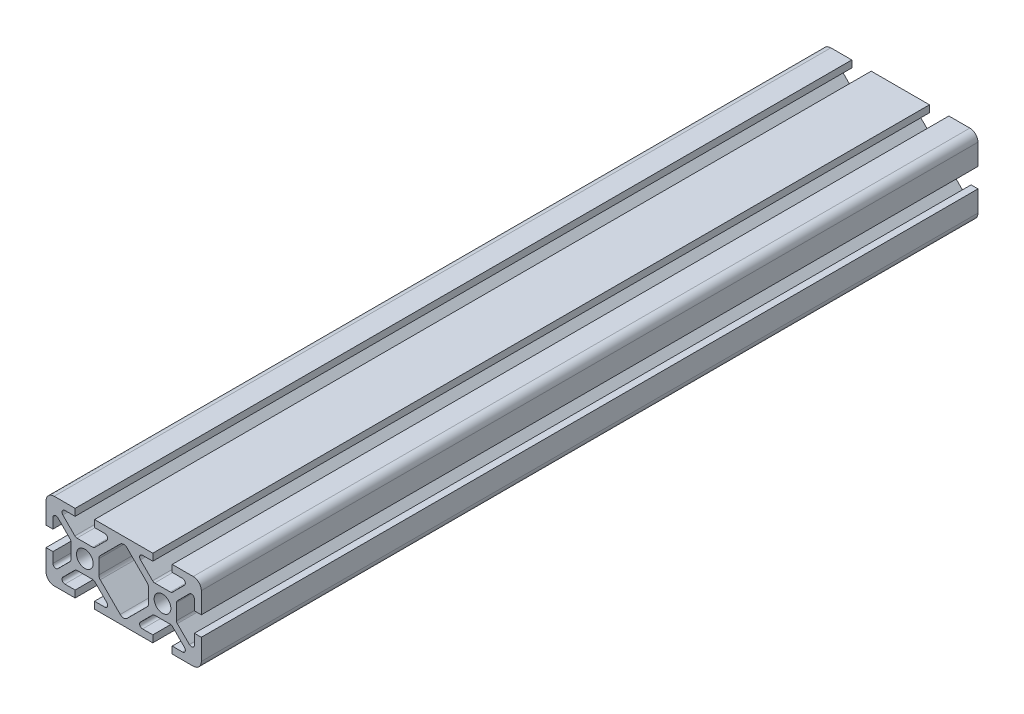
from build123d import *

# Parameters (mm, degrees)
BOSS_EXTRUDE1_DEPTH = 100.000000025
BOSS_EXTRUDE2_DEPTH = 100.000000025
FILLET1_R           = 0.75
FILLET2_R           = 1.25


with BuildPart() as part:
    # Sketch3 → Boss-Extrude1 (new, symmetric)
    with BuildSketch(Plane.XY):
        with BuildLine():
            Line((12.5, -10), (17.9, -10))
            ThreePointArc((17.9, -10), (19.38492424, -9.38492424), (20, -7.9))
            Line((20, -7.9), (20, -2.5))
            Line((20, -2.5), (18.213351365, -2.5))
            Line((18.213351365, -2.5), (18.213351365, -6.95))
            Line((18.213351365, -6.95), (13.6, -2.336648635))
            Line((13.6, -2.336648635), (13.6, 0))
            Line((13.6, 0), (12.15, 0))
            ThreePointArc((12.15, 0), (11.52027958, -1.52027958), (10, -2.15))
            Line((10, -2.15), (10, -3.6))
            Line((10, -3.6), (12.336648635, -3.6))
            Line((12.336648635, -3.6), (16.95, -8.213351365))
            Line((16.95, -8.213351365), (12.5, -8.213351365))
            Line((12.5, -8.213351365), (12.5, -10))
        make_face()
    extrude(amount=BOSS_EXTRUDE1_DEPTH, both=True)

    # Sketch4 → Boss-Extrude2 (add, symmetric)
    with BuildSketch(Plane.XY):
        with BuildLine():
            Line((10, -3.6), (7.663351365, -3.6))
            Line((7.663351365, -3.6), (3.05, -8.213351365))
            Line((3.05, -8.213351365), (7.5, -8.213351365))
            Line((7.5, -8.213351365), (7.5, -10))
            Line((7.5, -10), (0, -10))
            Line((0, -10), (0, -8.736648635))
            Line((0, -8.736648635), (6.4, -2.336648635))
            Line((6.4, -2.336648635), (6.4, 0))
            Line((6.4, 0), (7.85, 0))
            ThreePointArc((7.85, 0), (8.47972042, -1.52027958), (10, -2.15))
            Line((10, -2.15), (10, -3.6))
        make_face()
    extrude(amount=BOSS_EXTRUDE2_DEPTH, both=True)

    # Mirror1: part across plane


with BuildPart() as part_1:
    add(part.part)
    add(part.part.mirror(Plane(origin=(0, 0, 0), x_dir=(0, 0, 1), z_dir=(1, 0, 0))))

    # Mirror2: part across plane


with BuildPart() as part_2:
    add(part_1.part)
    add(part_1.part.mirror(Plane.ZX))

    # Fillet1
    fillet1_edges = [part_2.edges().sort_by_distance(p)[0] for p in [
        (18.213351365, 6.95, 0),
        (13.6, 2.336648635, 0),
        (12.336648635, 3.6, 0),
        (16.95, 8.213351365, 0),
        (3.05, 8.213351365, 0),
        (7.663351365, 3.6, 0),
        (-18.213351365, 6.95, 0),
        (-13.6, 2.336648635, 0),
        (-7.663351365, 3.6, 0),
        (-12.336648635, 3.6, 0),
        (-16.95, 8.213351365, 0),
        (-3.05, 8.213351365, 0),
        (16.95, -8.213351365, 0),
        (12.336648635, -3.6, 0),
        (13.6, -2.336648635, 0),
        (18.213351365, -6.95, 0),
        (3.05, -8.213351365, 0),
        (7.663351365, -3.6, 0),
        (-18.213351365, -6.95, 0),
        (-13.6, -2.336648635, 0),
        (-12.336648635, -3.6, 0),
        (-16.95, -8.213351365, 0),
        (-3.05, -8.213351365, 0),
        (-7.663351365, -3.6, 0),
    ]]
    fillet(fillet1_edges, radius=FILLET1_R)

    # Fillet2
    fillet2_edges = [part_2.edges().sort_by_distance(p)[0] for p in [
        (6.4, 2.336648635, 0),
        (0, 8.736648635, 0),
        (-6.4, 2.336648635, 0),
        (6.4, -2.336648635, 0),
        (-6.4, -2.336648635, 0),
        (0, -8.736648635, 0),
    ]]
    fillet(fillet2_edges, radius=FILLET2_R)


solid = part_2.part
